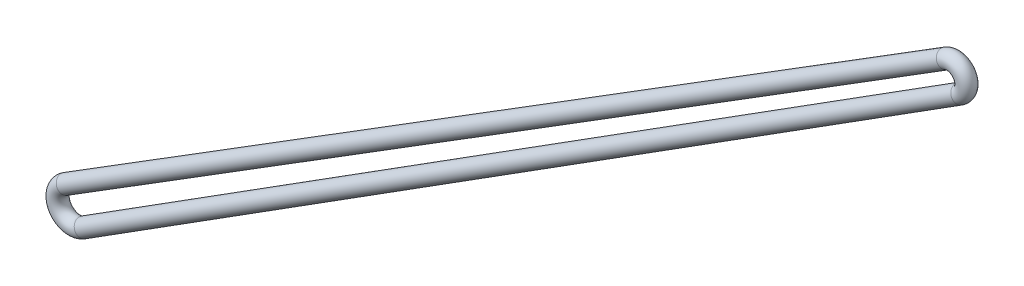
from build123d import *

# Parameters (mm, degrees)
SWEEP_1_PROFILE_R = 1.5


with BuildPart() as part:
    # 扫描1: sweep along a path in 草图2
    with BuildLine(Plane.XY) as sweep_1_path:
        Line((-1.639875101, 2.630743175), (159.598418774, 103.138715935))
        ThreePointArc((159.598418774, 103.138715935), (163.03827894, 102.34632187), (162.256751542, 98.903976559))
        Line((162.256751542, 98.903976559), (1.656457531, -2.620333652))
        ThreePointArc((1.656457531, -2.620333652), (-2.625551505, -1.648174534), (-1.639875101, 2.630743175))
    # 扫描1 profile (on start of the path) → 扫描1 (sweep)
    with BuildSketch(Plane(origin=(-1.639875101, 2.630743175, 0), x_dir=(-0.5289919679557532, 0.8486268307320358, 0), z_dir=(0.8486268307320358, 0.5289919679557532, 0))):
        Circle(SWEEP_1_PROFILE_R)
    sweep(path=sweep_1_path.line)


solid = part.part
